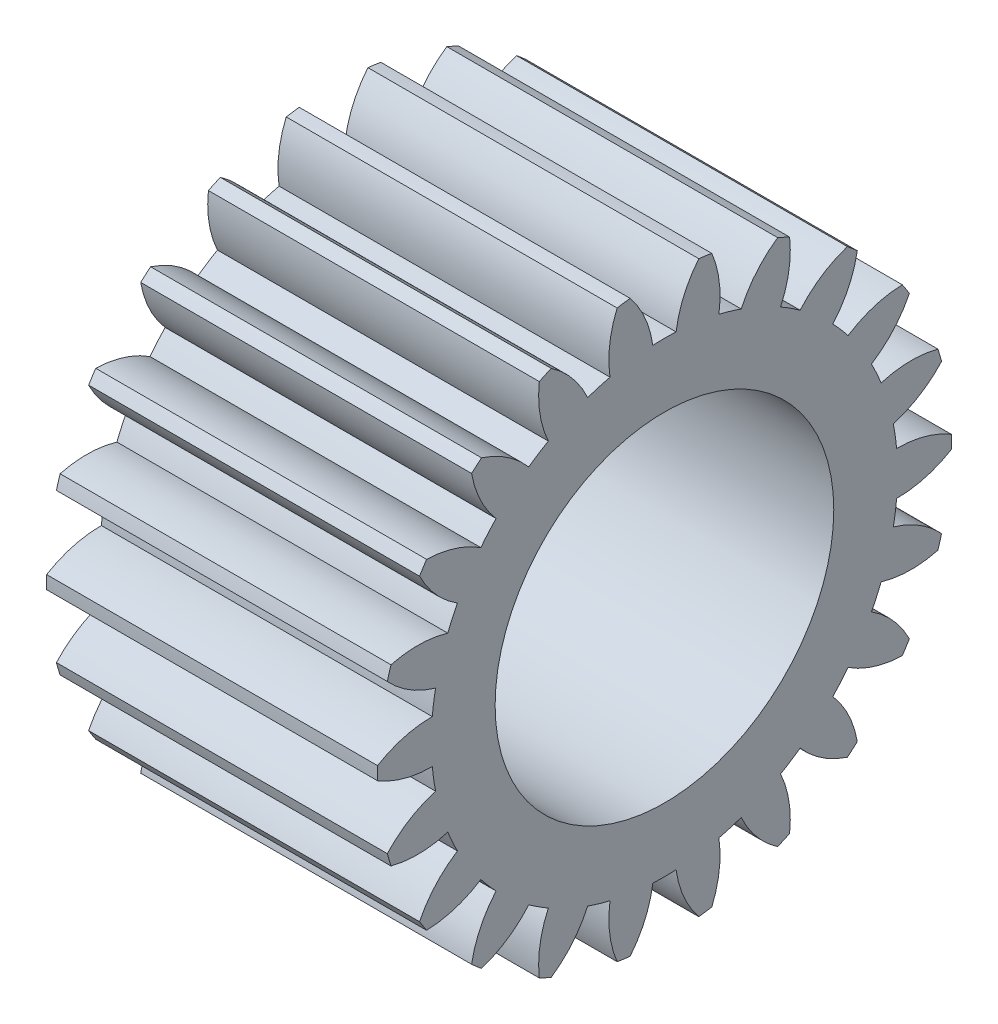
from build123d import *

# Parameters (mm, degrees)
BASPROSKE_W         = 44.5
BASPROSKE_H         = 30
TOOTHCUT_DEPTH      = 62.483737687
TEETHCUTS_COUNT     = 22
TEETHCUTS_ANGLE     = 343.636363636
HUBNEAONESKE_R      = 21
HUBNEARONE_DEPTH    = 5.5000508
BORSKE_R            = 12
BORE_DEPTH          = 50.0000508
CUT_EXTRUDE1_START  = -15.41
SKETCH1_R           = 30
CUT_EXTRUDE1_DEPTH  = 15.41
BOSS_EXTRUDE1_START = -3.95
SKETCH2_R           = 12
BOSS_EXTRUDE1_DEPTH = 3.95
SKETCH3_R           = 1.26
CUT_EXTRUDE2_DEPTH  = 55.622234789
SKETCH4_R           = 17.7
CUT_EXTRUDE3_DEPTH  = 30.64


with BuildPart() as part:
    # BasProSke → Base-Revolve (revolve)
    with BuildSketch(Plane(origin=(0, 0, 0), x_dir=(1, 0, 0), z_dir=(0, 1, 0)), mode=Mode.PRIVATE) as base_revolve_sk:
        with Locations((22.25, 15)):
            Rectangle(BASPROSKE_W, BASPROSKE_H)
    revolve(base_revolve_sk.sketch.rotate(Axis((-10, 0, 0), (1, 0, 0)), 180), axis=Axis((-10, 0, 0), (1, 0, 0)))

    # TooCutSke → ToothCut (cut, through all)
    with BuildSketch(Plane(origin=(0, 0, 0), x_dir=(0, 0, -1), z_dir=(1, 0, 0))):
        with BuildLine():
            ThreePointArc((1.215293185, 24.343683749), (0, 24.374), (-1.215293185, 24.343683749))
            ThreePointArc((-1.215293185, 24.343683749), (-2.034367134, 27.241050063), (-3.608361155, 29.807790507))
            ThreePointArc((-3.608361155, 29.807790507), (0, 30.0254), (3.608361155, 29.807790507))
            ThreePointArc((3.608361155, 29.807790507), (2.034367134, 27.241050063), (1.215293185, 24.343683749))
        make_face()
    toothcut = extrude(amount=TOOTHCUT_DEPTH, mode=Mode.SUBTRACT)

    # TeethCuts: ToothCut ×22 about axis
    teethcuts_axis = Axis((-10, 0, 0), (1, 0, 0))
    for i in range(1, TEETHCUTS_COUNT):
        add(toothcut.rotate(teethcuts_axis, i * TEETHCUTS_ANGLE / (TEETHCUTS_COUNT - 1)), mode=Mode.SUBTRACT)

    # HubNeaOneSke → HubNearOne (add)
    with BuildSketch(Plane.ZY):
        with Locations(Location((0, 0, 0), (0, 0, 180))):
            Circle(HUBNEAONESKE_R)
    extrude(amount=HUBNEARONE_DEPTH)

    # BorSke → Bore (cut, symmetric)
    with BuildSketch(Plane(origin=(0, 0, 0), x_dir=(0, 0, -1), z_dir=(1, 0, 0))):
        with Locations(Location((0, 0, 0), (0, 0, 180))):
            Circle(BORSKE_R)
    extrude(amount=BORE_DEPTH, both=True, mode=Mode.SUBTRACT)

    # Sketch1 → Cut-Extrude1 (cut)
    with BuildSketch(Plane.ZY.offset(5.5000508).offset(CUT_EXTRUDE1_START)):
        Circle(SKETCH1_R)
    extrude(amount=CUT_EXTRUDE1_DEPTH, mode=Mode.SUBTRACT)

    # Sketch2 → Boss-Extrude1 (add)
    with BuildSketch(Plane.ZY.offset(-9.9099492).offset(BOSS_EXTRUDE1_START)):
        Circle(SKETCH2_R)
    extrude(amount=BOSS_EXTRUDE1_DEPTH)

    # Sketch3 → Cut-Extrude2 (cut, through all)
    with BuildSketch(Plane.ZY.offset(-9.9099492)):
        with Locations((0, 8)):
            Circle(SKETCH3_R)
        with Locations((6.92820323, 4)):
            Circle(SKETCH3_R)
        with Locations((6.92820323, -4)):
            Circle(SKETCH3_R)
        with Locations((0, -8)):
            Circle(SKETCH3_R)
        with Locations((-6.92820323, -4)):
            Circle(SKETCH3_R)
        with Locations((-6.92820323, 4)):
            Circle(SKETCH3_R)
    extrude(amount=-CUT_EXTRUDE2_DEPTH, mode=Mode.SUBTRACT)

    # Sketch4 → Cut-Extrude3 (cut)
    with BuildSketch(Plane(origin=(44.5, 0, 0), x_dir=(0, 0, -1), z_dir=(1, 0, 0))):
        Circle(SKETCH4_R)
    extrude(amount=-CUT_EXTRUDE3_DEPTH, mode=Mode.SUBTRACT)


solid = part.part
